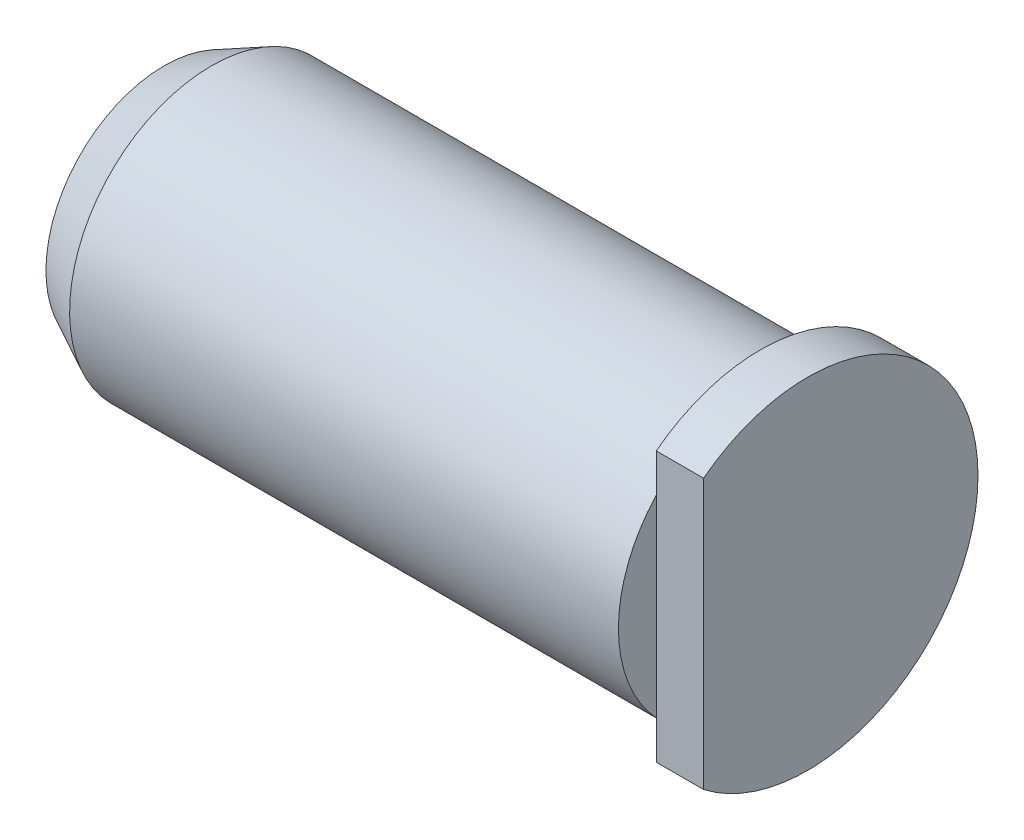
from build123d import *

# Parameters (mm, degrees)
SKETCH_2_W          = 14
SKETCH_2_H          = 72
CUT_EXTRUDE_1_DEPTH = 10


with BuildPart() as part:
    # 草图1 → 旋转1 (revolve)
    with BuildSketch(Plane.XY):
        Polygon((0, 0), (-136, 0), (-136, 25), (-126, 30), (-10, 30), (-10, 36), (0, 36), align=None)
    revolve(axis=Axis((0, 0, 0), (-1, 0, 0)))

    # 草图2 → 切除-拉伸1 (cut)
    with BuildSketch(Plane(origin=(0, 0, 0), x_dir=(0, 0, -1), z_dir=(1, 0, 0))):
        with Locations((-29, 0)):
            Rectangle(SKETCH_2_W, SKETCH_2_H)
    extrude(amount=-CUT_EXTRUDE_1_DEPTH, mode=Mode.SUBTRACT)


solid = part.part
